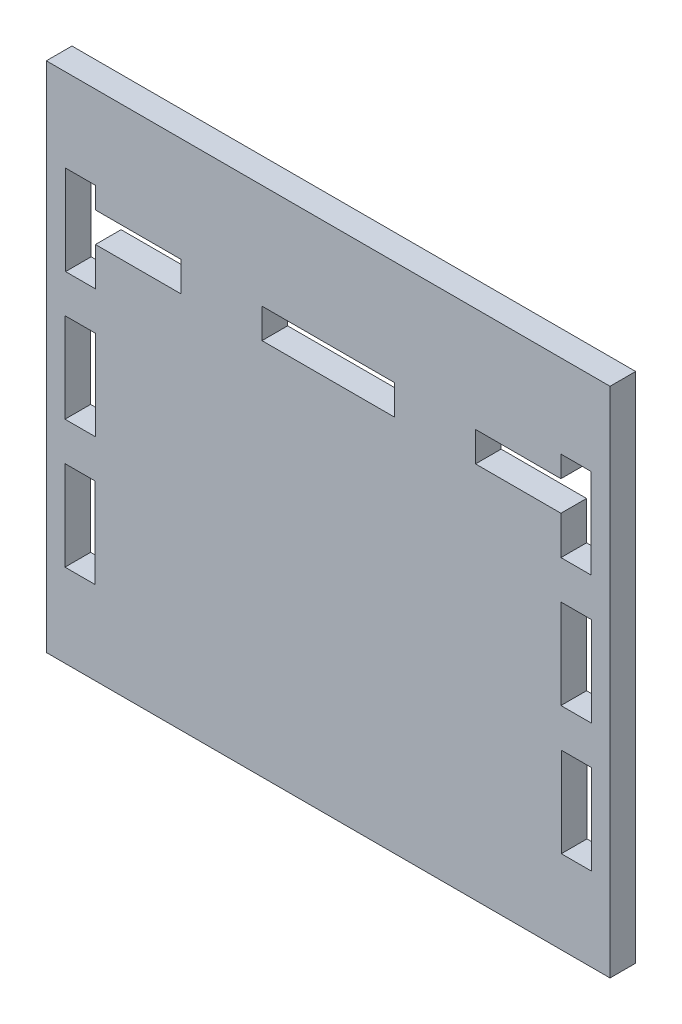
from build123d import *

# Parameters (mm, degrees)
SKETCH_1_W      = 66
SKETCH_1_H      = 60
SKETCH_1_W_2    = 15.5
SKETCH_1_H_2    = 3.5
SKETCH_1_W_3    = 3.566819074
SKETCH_1_H_3    = 10.5
SKETCH_1_W_4    = 3.520169939
EXTRUDE_1_DEPTH = 3


with BuildPart() as part:
    # Эскиз1 → Бобышка-Вытянуть1 (new body)
    with BuildSketch(Plane.XY):
        Rectangle(SKETCH_1_W, SKETCH_1_H)
        with Locations((0, 16)):
            Rectangle(SKETCH_1_W_2, SKETCH_1_H_2, mode=Mode.SUBTRACT)
        Polygon((-17.25, 17.75), (-27.25, 17.75), (-27.25, 20.25), (-30.75, 20.25), (-30.75, 9.75), (-27.25, 9.75), (-27.25, 14.25), (-17.25, 14.25), align=None, mode=Mode.SUBTRACT)
        with Locations((-29.033409537, 0)):
            Rectangle(SKETCH_1_W_3, SKETCH_1_H_3, mode=Mode.SUBTRACT)
        with Locations((-29.056734105, -15)):
            Rectangle(SKETCH_1_W_4, SKETCH_1_H_3, mode=Mode.SUBTRACT)
        with Locations((29.056734105, -15)):
            Rectangle(SKETCH_1_W_4, SKETCH_1_H_3, mode=Mode.SUBTRACT)
        with Locations((29.033409537, 0)):
            Rectangle(SKETCH_1_W_3, SKETCH_1_H_3, mode=Mode.SUBTRACT)
        Polygon((27.25, 20.25), (27.25, 17.75), (17.25, 17.75), (17.25, 14.25), (27.25, 14.25), (27.25, 9.75), (30.75, 9.75), (30.75, 20.25), align=None, mode=Mode.SUBTRACT)
    extrude(amount=EXTRUDE_1_DEPTH)


solid = part.part
